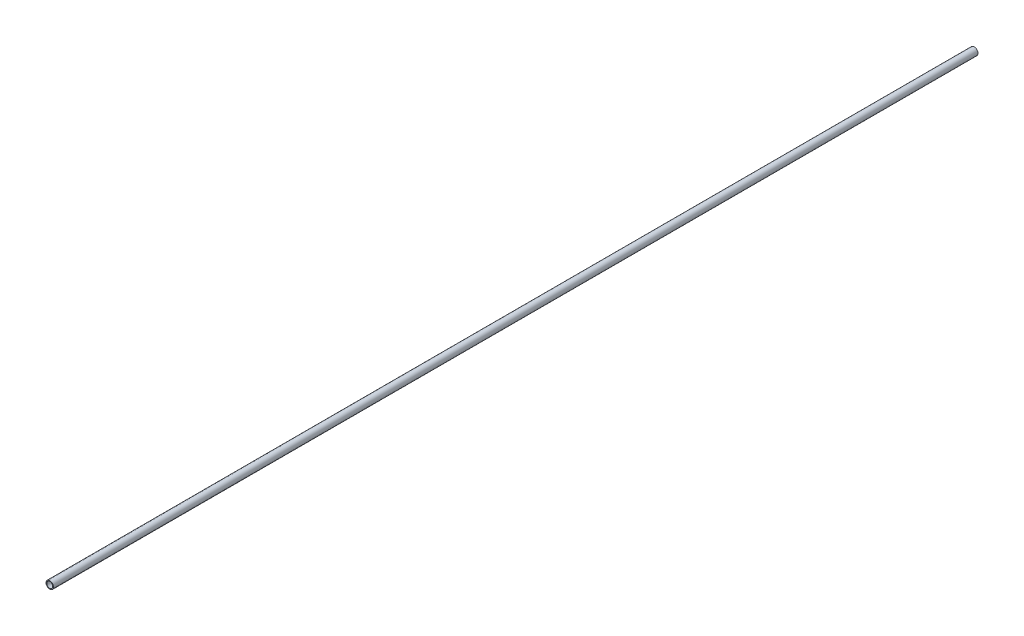
from build123d import *

# Parameters (mm, degrees)
SKETCH_1_R      = 5
SKETCH_1_R_2    = 4
EXTRUDE_1_DEPTH = 1230


with BuildPart() as part:
    # 草图1 → 凸台-拉伸1 (new body)
    with BuildSketch(Plane.XY):
        Circle(SKETCH_1_R)
        Circle(SKETCH_1_R_2, mode=Mode.SUBTRACT)
    extrude(amount=EXTRUDE_1_DEPTH)


solid = part.part
